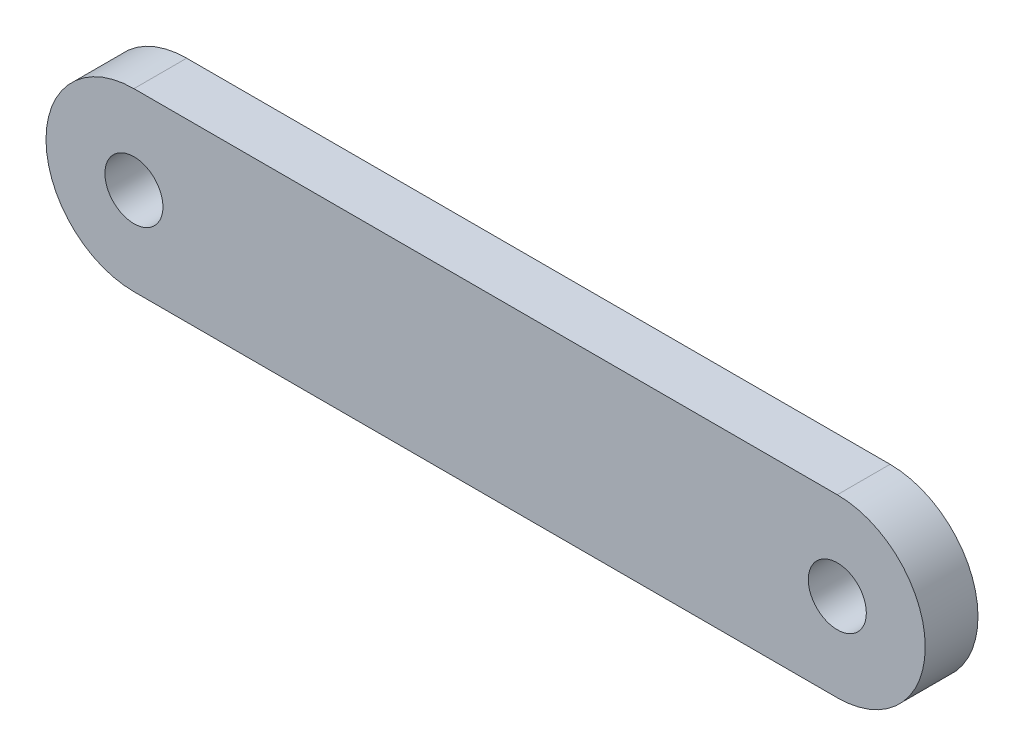
from build123d import *

# Parameters (mm, degrees)
SKETCH_1_R      = 1.65
EXTRUDE_1_DEPTH = 3


with BuildPart() as part:
    # 草图1 → 凸台-拉伸1 (new body)
    with BuildSketch(Plane.XY):
        with BuildLine():
            Line((0, 0), (40, 0))
            ThreePointArc((40, 0), (45, -5), (40, -10))
            Line((40, -10), (0, -10))
            ThreePointArc((0, -10), (-5, -5), (0, 0))
        make_face()
        with Locations((0, -5)):
            Circle(SKETCH_1_R, mode=Mode.SUBTRACT)
        with Locations((40, -5)):
            Circle(SKETCH_1_R, mode=Mode.SUBTRACT)
    extrude(amount=EXTRUDE_1_DEPTH)


solid = part.part
